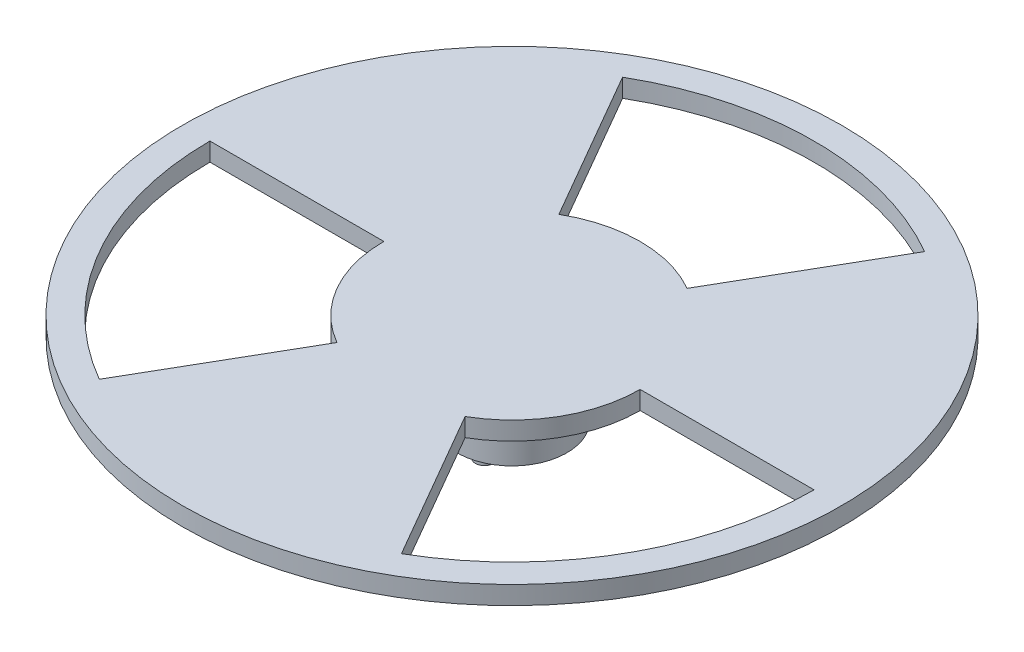
from build123d import *

# Parameters (mm, degrees)
SKETCH1_R                = 18
BOSS_EXTRUDE1_DEPTH      = 1
SKETCH4_R                = 0.5
CUT_EXTRUDE2_DEPTH       = 1
BOSS_EXTRUDE2_DEPTH      = 4
BOSS_EXTRUDE2_DEPTH_BACK = 1
SKETCH5_R                = 3
BOSS_EXTRUDE3_START      = -5
SKETCH4_3_R              = 0.5
BOSS_EXTRUDE3_DEPTH      = 1


with BuildPart() as part:
    # Sketch1 → Boss-Extrude1 (new body)
    with BuildSketch(Plane(origin=(0, 0, 0), x_dir=(1, 0, 0), z_dir=(0, 1, 0))):
        with Locations(Location((0, 0, 0), (0, 0, 270))):
            Circle(SKETCH1_R)
    extrude(amount=BOSS_EXTRUDE1_DEPTH)

    # Sketch4 → Cut-Extrude2 (cut)
    with BuildSketch(Plane(origin=(0, 1, 0), x_dir=(1, 0, 0), z_dir=(0, 1, 0))):
        with Locations(Location((1.299038106, 0.75, 0), (0, 0, 270))):
            Circle(SKETCH4_R)
        with Locations(Location((0, -1.5, 0), (0, 0, 270))):
            Circle(SKETCH4_R)
        with Locations(Location((-1.299038106, 0.75, 0), (0, 0, 270))):
            Circle(SKETCH4_R)
        with BuildLine():
            Line((-3.5, 6.062177826), (-8.25, 14.289419162))
            ThreePointArc((-8.25, 14.289419162), (0, 16.5), (8.25, 14.289419162))
            Line((8.25, 14.289419162), (3.5, 6.062177826))
            ThreePointArc((3.5, 6.062177826), (0, 7), (-3.5, 6.062177826))
        make_face()
        with BuildLine():
            Line((7, 0), (16.5, 0))
            ThreePointArc((16.5, 0), (14.289419162, -8.25), (8.25, -14.289419162))
            Line((8.25, -14.289419162), (3.5, -6.062177826))
            ThreePointArc((3.5, -6.062177826), (6.062177826, -3.5), (7, 0))
        make_face()
        with BuildLine():
            Line((-3.5, -6.062177826), (-8.25, -14.289419162))
            ThreePointArc((-8.25, -14.289419162), (-14.289419162, -8.25), (-16.5, 0))
            Line((-16.5, 0), (-7, 0))
            ThreePointArc((-7, 0), (-6.062177826, -3.5), (-3.5, -6.062177826))
        make_face()
    extrude(amount=-CUT_EXTRUDE2_DEPTH, mode=Mode.SUBTRACT)

    # Sketch5 → Boss-Extrude2 (add, two sides: drawn at the far end of the back side and taken through both)
    with BuildSketch(Plane.XZ.offset(-BOSS_EXTRUDE2_DEPTH_BACK)):
        with Locations(Location((0, 0, 0), (0, 0, 270))):
            Circle(SKETCH5_R)
    extrude(amount=BOSS_EXTRUDE2_DEPTH + BOSS_EXTRUDE2_DEPTH_BACK)

    # Sketch4<3> → Boss-Extrude3 (add)
    with BuildSketch(Plane(origin=(0, 1, 0), x_dir=(1, 0, 0), z_dir=(0, 1, 0)).offset(BOSS_EXTRUDE3_START)):
        with Locations(Location((0, -1.5, 0), (0, 0, 90))):
            Circle(SKETCH4_3_R)
        with Locations(Location((-1.299038106, 0.75, 0), (0, 0, 90))):
            Circle(SKETCH4_3_R)
        with Locations(Location((1.299038106, 0.75, 0), (0, 0, 90))):
            Circle(SKETCH4_3_R)
    extrude(amount=-BOSS_EXTRUDE3_DEPTH)


solid = part.part
